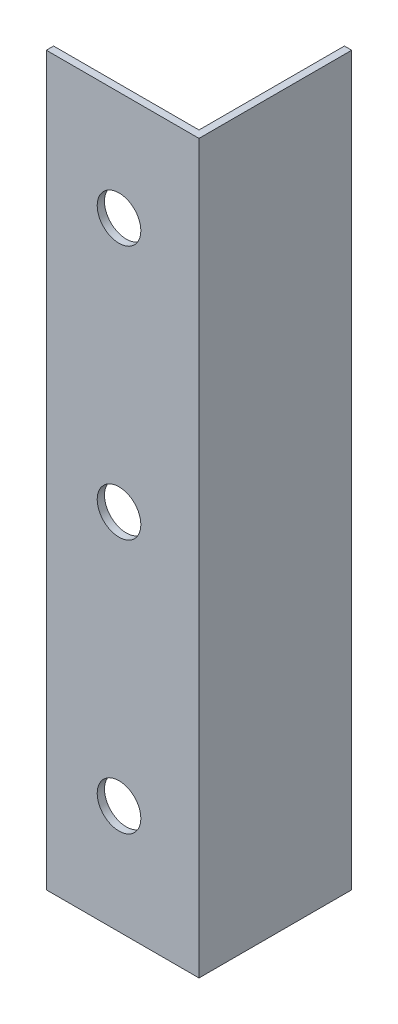
from build123d import *

# Parameters (mm, degrees)
BOSS_EXTRUDE1_DEPTH = 100
SKETCH2_R           = 3
CUT_EXTRUDE1_DEPTH  = 10


with BuildPart() as part:
    # Sketch1 → Boss-Extrude1 (new body)
    with BuildSketch(Plane(origin=(0, 0, 0), x_dir=(1, 0, 0), z_dir=(0, 1, 0))):
        Polygon((0, 0), (0, 1), (20, 1), (20, 21), (21, 21), (21, 0), align=None)
    extrude(amount=BOSS_EXTRUDE1_DEPTH)

    # Sketch2 → Cut-Extrude1 (cut)
    with BuildSketch(Plane(origin=(0, 0, -1), x_dir=(-1, 0, 0), z_dir=(0, 0, -1))):
        with Locations((-10, 15)):
            Circle(SKETCH2_R)
        with Locations((-10, 50)):
            Circle(SKETCH2_R)
        with Locations((-10, 85)):
            Circle(SKETCH2_R)
    extrude(amount=-CUT_EXTRUDE1_DEPTH, mode=Mode.SUBTRACT)


solid = part.part
